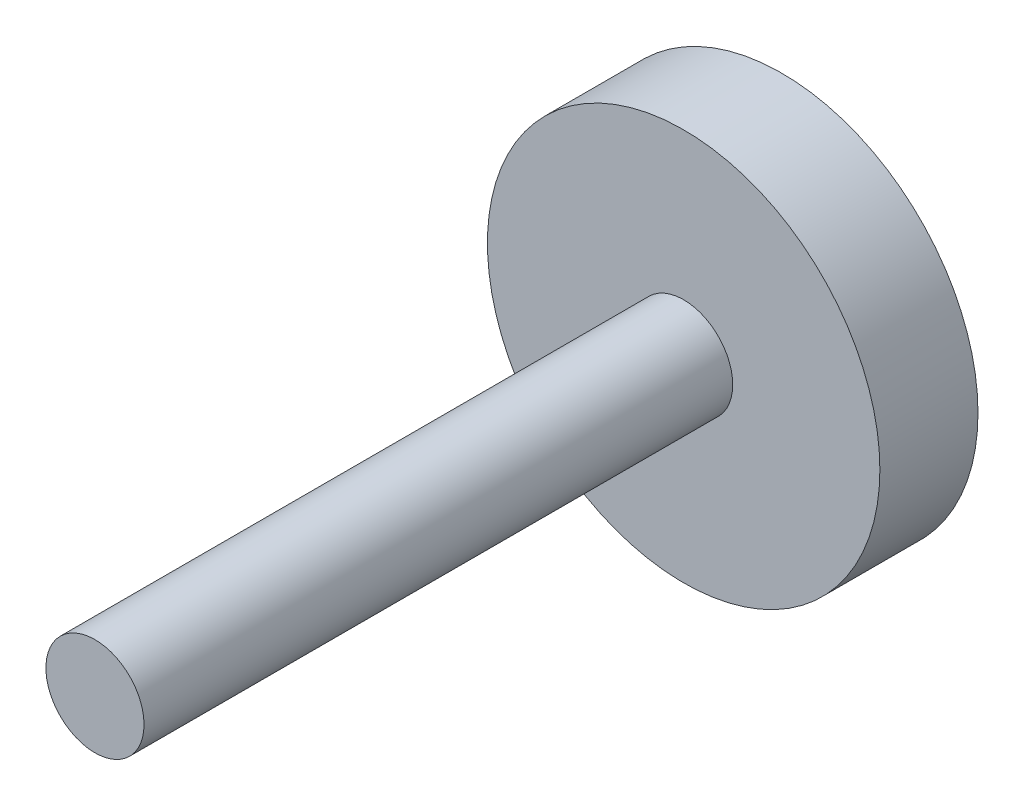
from build123d import *

# Parameters (mm, degrees)
SKETCH1_R           = 5
BOSS_EXTRUDE1_DEPTH = 1.25
SKETCH2_R           = 1.25
BOSS_EXTRUDE2_DEPTH = 15


with BuildPart() as part:
    # Sketch1 → Boss-Extrude1 (new, symmetric)
    with BuildSketch(Plane.XY):
        Circle(SKETCH1_R)
    extrude(amount=BOSS_EXTRUDE1_DEPTH, both=True)

    # Sketch2 → Boss-Extrude2 (add)
    with BuildSketch(Plane.XY.offset(1.25)):
        Circle(SKETCH2_R)
    extrude(amount=BOSS_EXTRUDE2_DEPTH)


solid = part.part
